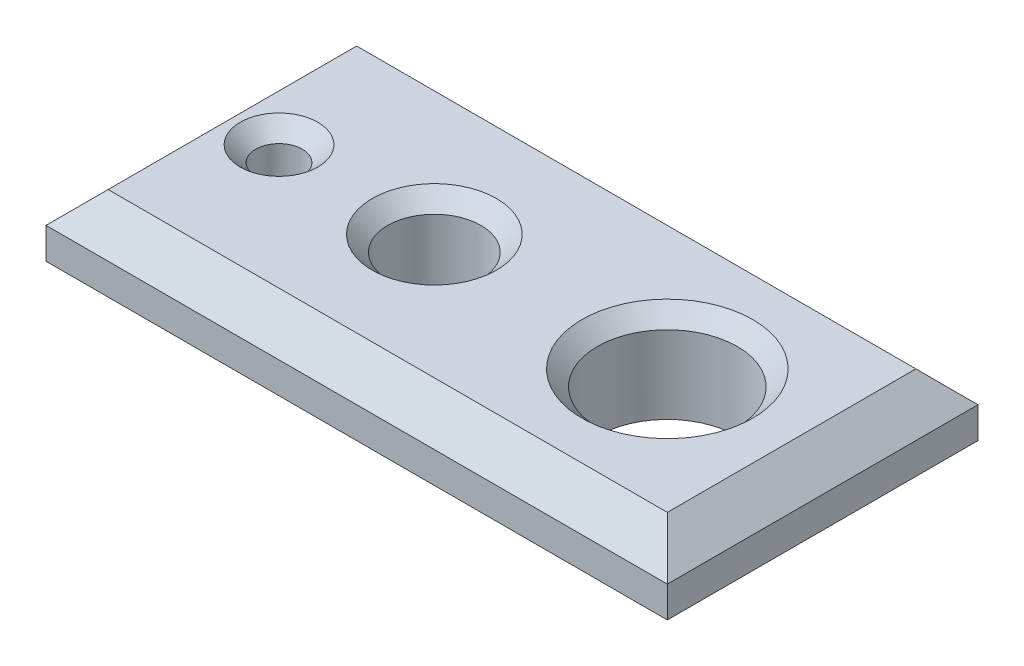
from build123d import *

# Parameters (mm, degrees)
SKETCH_1_W          = 200
SKETCH_1_H          = 100
EXTRUDE_1_DEPTH     = 30
SKETCH_2_R          = 7.5
SKETCH_2_R_2        = 15
SKETCH_2_R_3        = 22.5
CUT_EXTRUDE_1_DEPTH = 30
CHAMFER_1_SIZE      = 10
CHAMFER_3_SIZE      = 5


with BuildPart() as part:
    # 草圖1 → 填料-伸長1 (new body)
    with BuildSketch(Plane(origin=(0, 0, 0), x_dir=(1, 0, 0), z_dir=(0, 1, 0))):
        with Locations((100, 50)):
            Rectangle(SKETCH_1_W, SKETCH_1_H)
    extrude(amount=EXTRUDE_1_DEPTH)

    # 草圖2 → 除料-伸長1 (cut)
    with BuildSketch(Plane(origin=(0, 30, 0), x_dir=(1, 0, 0), z_dir=(0, 1, 0))):
        with Locations(Location((25, 50, 0), (0, 0, 270))):
            Circle(SKETCH_2_R)
        with Locations(Location((75, 50, 0), (0, 0, 270))):
            Circle(SKETCH_2_R_2)
        with Locations(Location((150, 50, 0), (0, 0, 270))):
            Circle(SKETCH_2_R_3)
    extrude(amount=-CUT_EXTRUDE_1_DEPTH, mode=Mode.SUBTRACT)

    # 導角1
    chamfer_1_edges = [part.edges().sort_by_distance(p)[0] for p in [
        (200, 30, -50),
        (100, 30, -100),
        (0, 30, -50),
        (100, 0, -100),
        (200, 0, -50),
        (100, 0, 0),
        (0, 0, -50),
        (100, 30, 0),
    ]]
    chamfer(chamfer_1_edges, length=CHAMFER_1_SIZE)

    # 導角3
    chamfer_3_edges = [part.edges().sort_by_distance(p)[0] for p in [
        (25, 30, -57.5),
        (75, 30, -65),
        (150, 30, -72.5),
    ]]
    chamfer(chamfer_3_edges, length=CHAMFER_3_SIZE)


solid = part.part
